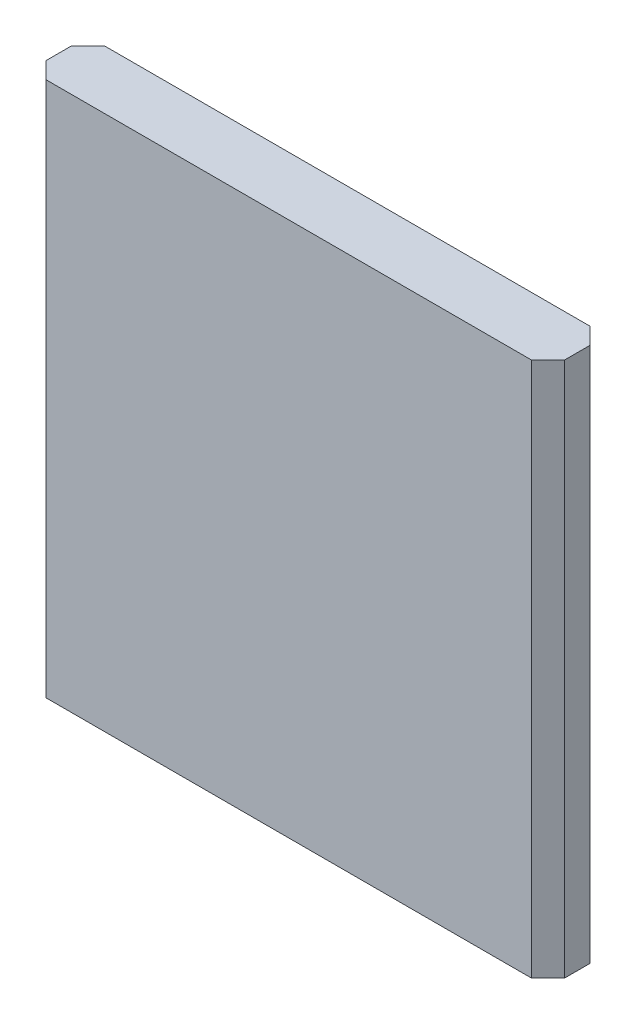
from build123d import *

# Parameters (mm, degrees)
ESBO_O1_W                = 310
ESBO_O1_H                = 320
RESSALTO_EXTRUS_O1_DEPTH = 35
CHANFRO1_SIZE            = 10


with BuildPart() as part:
    # Esboço1 → Ressalto-extrusão1 (new body)
    with BuildSketch(Plane.XY):
        with Locations((-200, -190)):
            Rectangle(ESBO_O1_W, ESBO_O1_H)
    extrude(amount=RESSALTO_EXTRUS_O1_DEPTH)

    # Chanfro1
    chanfro1_edges = [part.edges().sort_by_distance(p)[0] for p in [
        (-355, -190, 35),
        (-45, -190, 35),
        (-355, -190, 0),
        (-45, -190, 0),
    ]]
    chamfer(chanfro1_edges, length=CHANFRO1_SIZE)


solid = part.part
